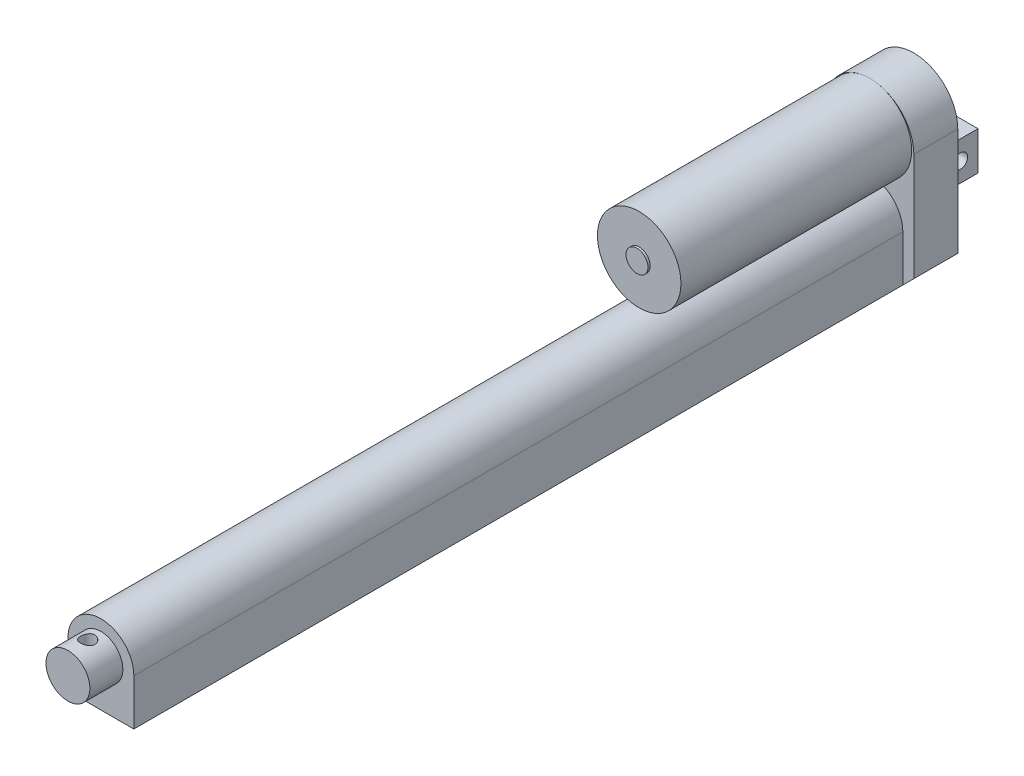
from build123d import *

# Parameters (mm, degrees)
SKETCH1_W               = 40
SKETCH1_H               = 74
BOSS_EXTRUDE1_DEPTH     = 20
FILLET1_RADIUS          = 20
FILLET1_LENGTH          = 20
CHAMFER1_SIZE           = 5
CHAMFER2_SIZE           = 5
SKETCH2_R               = 19
BOSS_EXTRUDE2_DEPTH     = 105
SKETCH3_R               = 5
BOSS_EXTRUDE3_DEPTH     = 1
SKETCH5_W               = 30
SKETCH5_H               = 36
BOSS_EXTRUDE4_DEPTH     = 350
FILLET2_RADIUS          = 15
FILLET2_LENGTH          = 350
SKETCH6_R               = 10
BOSS_EXTRUDE5_DEPTH     = 15
CUT_EXTRUDE1_DEPTH      = 391.476447911
CUT_EXTRUDE1_DEPTH_BACK = 391.476447911
SKETCH8_R               = 3.25
SKETCH9_W               = 17.5
SKETCH9_H               = 17.5
BOSS_EXTRUDE6_DEPTH     = 19
SKETCH11_R              = 3.25
CUT_EXTRUDE3_DEPTH      = 388.953947021


with BuildPart() as part:
    # Sketch1 → Boss-Extrude1 (new body)
    with BuildSketch(Plane.XY):
        Rectangle(SKETCH1_W, SKETCH1_H)
    extrude(amount=BOSS_EXTRUDE1_DEPTH)

    # Fillet1: full round fillet: the end face becomes a half cylinder, R = half its width
    fillet1_face = Plane((0, 37, 10), x_dir=(0, 0, 1), z_dir=(0, 1, 0))  # on the end face: x along it, z out of the body
    fillet1_slab = fillet1_face.offset(-FILLET1_RADIUS / 2) * Box(FILLET1_LENGTH, 2 * FILLET1_RADIUS, FILLET1_RADIUS, mode=Mode.PRIVATE)  # the body's end, R deep
    fillet1_round = Plane((0, 17, 10), x_dir=(0, 1, 0), z_dir=(0, 0, 1)) * Cylinder(FILLET1_RADIUS, FILLET1_LENGTH, mode=Mode.PRIVATE)  # its axis R under the face
    add(fillet1_slab - fillet1_round, mode=Mode.SUBTRACT)

    # Chamfer1
    chamfer1_edges = [part.edges().sort_by_distance(p)[0] for p in [
        (-20, -37, 10),
    ]]
    chamfer(chamfer1_edges, length=CHAMFER1_SIZE)

    # Chamfer2
    chamfer2_edges = [part.edges().sort_by_distance(p)[0] for p in [
        (20, -37, 10),
    ]]
    chamfer(chamfer2_edges, length=CHAMFER2_SIZE)

    # Sketch2 → Boss-Extrude2 (add)
    with BuildSketch(Plane.XY.offset(20)):
        with Locations(Location((0, 18.023030993, 0), (0, 0, 102.501860176))):
            Circle(SKETCH2_R)
    extrude(amount=BOSS_EXTRUDE2_DEPTH)

    # Sketch3 → Boss-Extrude3 (add)
    with BuildSketch(Plane.XY.offset(125)):
        with Locations((0, 18.023030993)):
            Circle(SKETCH3_R)
    extrude(amount=BOSS_EXTRUDE3_DEPTH)

    # Sketch5 → Boss-Extrude4 (add)
    with BuildSketch(Plane.XY.offset(20)):
        with Locations((0, -19)):
            Rectangle(SKETCH5_W, SKETCH5_H)
    extrude(amount=BOSS_EXTRUDE4_DEPTH)

    # Fillet2: full round fillet: the end face becomes a half cylinder, R = half its width
    fillet2_face = Plane((0, -1, 195), x_dir=(0, 0, 1), z_dir=(0, 1, 0))  # on the end face: x along it, z out of the body
    fillet2_slab = fillet2_face.offset(-FILLET2_RADIUS / 2) * Box(FILLET2_LENGTH, 2 * FILLET2_RADIUS, FILLET2_RADIUS, mode=Mode.PRIVATE)  # the body's end, R deep
    fillet2_round = Plane((0, -16, 195), x_dir=(0, 1, 0), z_dir=(0, 0, 1)) * Cylinder(FILLET2_RADIUS, FILLET2_LENGTH, mode=Mode.PRIVATE)  # its axis R under the face
    add(fillet2_slab - fillet2_round, mode=Mode.SUBTRACT)

    # Sketch6 → Boss-Extrude5 (add)
    with BuildSketch(Plane.XY.offset(370)):
        with Locations((0, -16)):
            Circle(SKETCH6_R)
    extrude(amount=BOSS_EXTRUDE5_DEPTH)

    # Sketch8 → Cut-Extrude1 (cut, two sides: drawn at the far end of the back side and taken through both)
    with BuildSketch(Plane(origin=(0, -25, 0), x_dir=(1, 0, 0), z_dir=(0, 1, 0)).offset(-CUT_EXTRUDE1_DEPTH_BACK)):
        with Locations(Location((0, -376, 0), (0, 0, 270))):
            Circle(SKETCH8_R)
    extrude(amount=CUT_EXTRUDE1_DEPTH + CUT_EXTRUDE1_DEPTH_BACK, mode=Mode.SUBTRACT)

    # Sketch9 → Boss-Extrude6 (add)
    with BuildSketch(Plane(origin=(0, 0, 0), x_dir=(-1, 0, 0), z_dir=(0, 0, -1))):
        with Locations((-1.458609833, -6)):
            Rectangle(SKETCH9_W, SKETCH9_H)
    extrude(amount=BOSS_EXTRUDE6_DEPTH)

    # Sketch11 → Cut-Extrude3 (cut, through all)
    with BuildSketch(Plane(origin=(10.208609833, 0, 0), x_dir=(0, 0, -1), z_dir=(1, 0, 0))):
        with Locations(Location((11, -6, 0), (0, 0, 90))):
            Circle(SKETCH11_R)
    extrude(amount=-CUT_EXTRUDE3_DEPTH, mode=Mode.SUBTRACT)


solid = part.part
